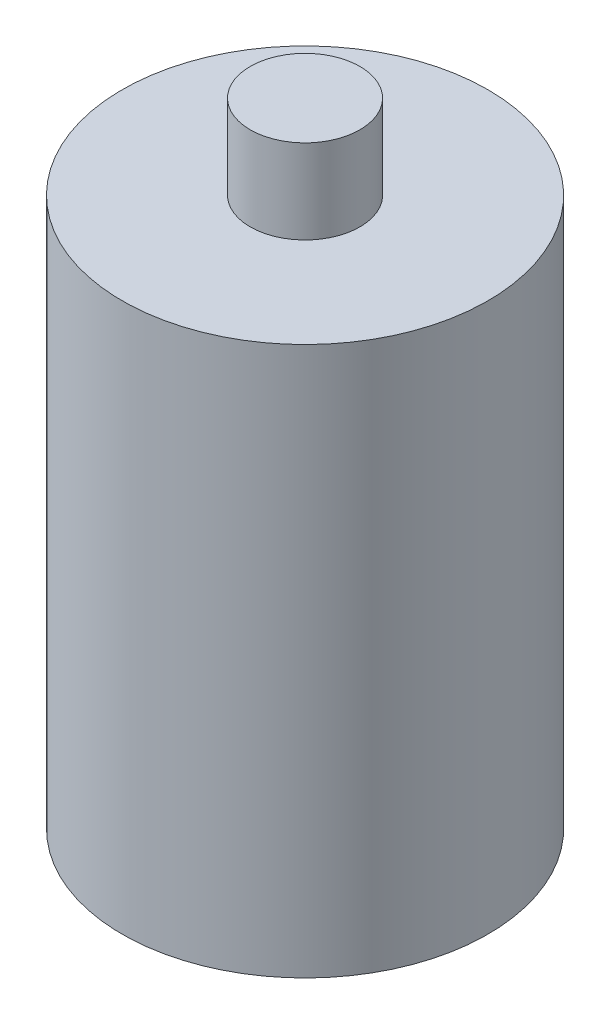
from build123d import *

# Parameters (mm, degrees)
SKETCH1_R           = 12.7
BOSS_EXTRUDE1_DEPTH = 38.1
SKETCH2_R           = 3.81
BOSS_EXTRUDE2_DEPTH = 5.842


with BuildPart() as part:
    # Sketch1 → Boss-Extrude1 (new body)
    with BuildSketch(Plane(origin=(0, 0, 0), x_dir=(1, 0, 0), z_dir=(0, 1, 0))):
        with Locations(Location((0, 0, 0), (0, 0, 90))):
            Circle(SKETCH1_R)
    extrude(amount=BOSS_EXTRUDE1_DEPTH)

    # Sketch2 → Boss-Extrude2 (add)
    with BuildSketch(Plane(origin=(0, 38.1, 0), x_dir=(1, 0, 0), z_dir=(0, 1, 0))):
        with Locations(Location((0, 0, 0), (0, 0, 270))):
            Circle(SKETCH2_R)
    extrude(amount=BOSS_EXTRUDE2_DEPTH)


solid = part.part
